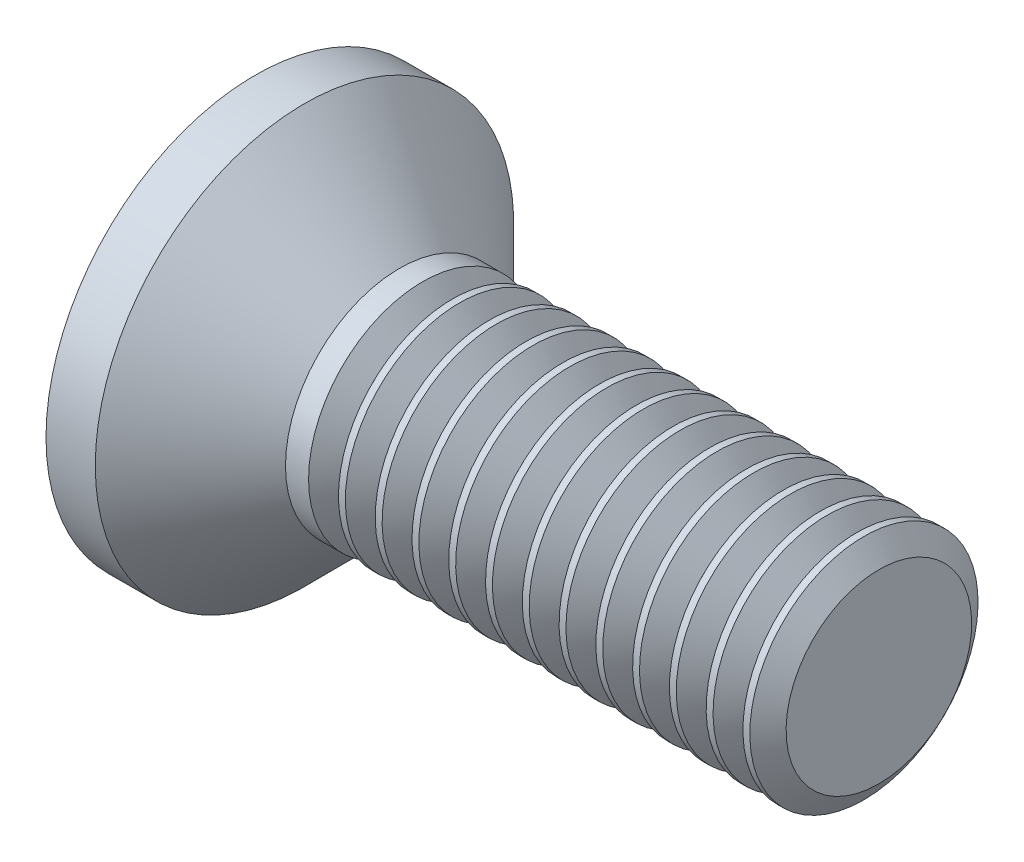
from build123d import *

# Parameters (mm, degrees)
CIRPATTERN1_COUNT = 2
CIRPATTERN1_ANGLE = 90
THDSCHPAT_COUNT   = 13
THDSCHPAT_PITCH   = 0.483333333


with BuildPart() as part:
    # BodySke → Base-Revolve (revolve)
    with BuildSketch(Plane.XY, mode=Mode.PRIVATE) as base_revolve_sk:
        with BuildLine():
            Line((0, 0), (8.727669073, 0))
            Line((8.727669073, 0), (8.727669073, 1.5))
            Line((8.727669073, 1.5), (2.427669073, 1.5))
            Line((2.427669073, 1.5), (1.177669073, 2.75))
            Line((1.177669073, 2.75), (0.529956332, 2.75))
            ThreePointArc((0.529956332, 2.75), (0.133696843, 1.400299407), (0, 0))
        make_face()
    revolve(base_revolve_sk.sketch.rotate(Axis((-15.875, 0, 0), (1, 0, 0)), 90), axis=Axis((-15.875, 0, 0), (1, 0, 0)))

    # Sketch3 → Cross section 0
    with BuildSketch(Plane(origin=(0, 0, 0), x_dir=(0, 0, -1), z_dir=(1, 0, 0))):
        with BuildLine():
            Line((0.415, -1.72), (-0.415, -1.72))
            Line((-0.415, -1.72), (-0.415, 1.72))
            Line((-0.415, 1.72), (0.415, 1.72))
            Line((0.415, 1.72), (0.415, -1.72))
        make_face()
    # Sketch4 → Cross section 1
    with BuildSketch(Plane(origin=(2.33, 0, 0), x_dir=(0, 0, -1), z_dir=(1, 0, 0))):
        with BuildLine():
            Line((0.2075, -0.2075), (-0.2075, -0.2075))
            Line((-0.2075, -0.2075), (-0.2075, 0.2075))
            Line((-0.2075, 0.2075), (0.2075, 0.2075))
            Line((0.2075, 0.2075), (0.2075, -0.2075))
        make_face()
    cross = loft(mode=Mode.SUBTRACT)

    # CirPattern1: Cross ×2 about axis
    cirpattern1_axis = Axis((0, 0, 0), (1, 0, 0))
    for i in range(1, CIRPATTERN1_COUNT):
        add(cross.rotate(cirpattern1_axis, i * CIRPATTERN1_ANGLE / (CIRPATTERN1_COUNT - 1)), mode=Mode.SUBTRACT)

    # ThdSchSke → ThreadSchematic (revolve, cut)
    with BuildSketch(Plane.XY):
        Polygon((2.927669073, -1.2195), (2.731260858, -1.5), (2.731260858, -1.875), (3.124077287, -1.875), (3.124077287, -1.5), align=None)
    threadschematic = revolve(axis=Axis((-3.175, 0, 0), (1, 0, 0)), mode=Mode.SUBTRACT)

    # ThdSchPat: ThreadSchematic ×13
    with Locations(*[(i * THDSCHPAT_PITCH, 0, 0) for i in range(1, THDSCHPAT_COUNT)]):
        add(threadschematic, mode=Mode.SUBTRACT)


solid = part.part
